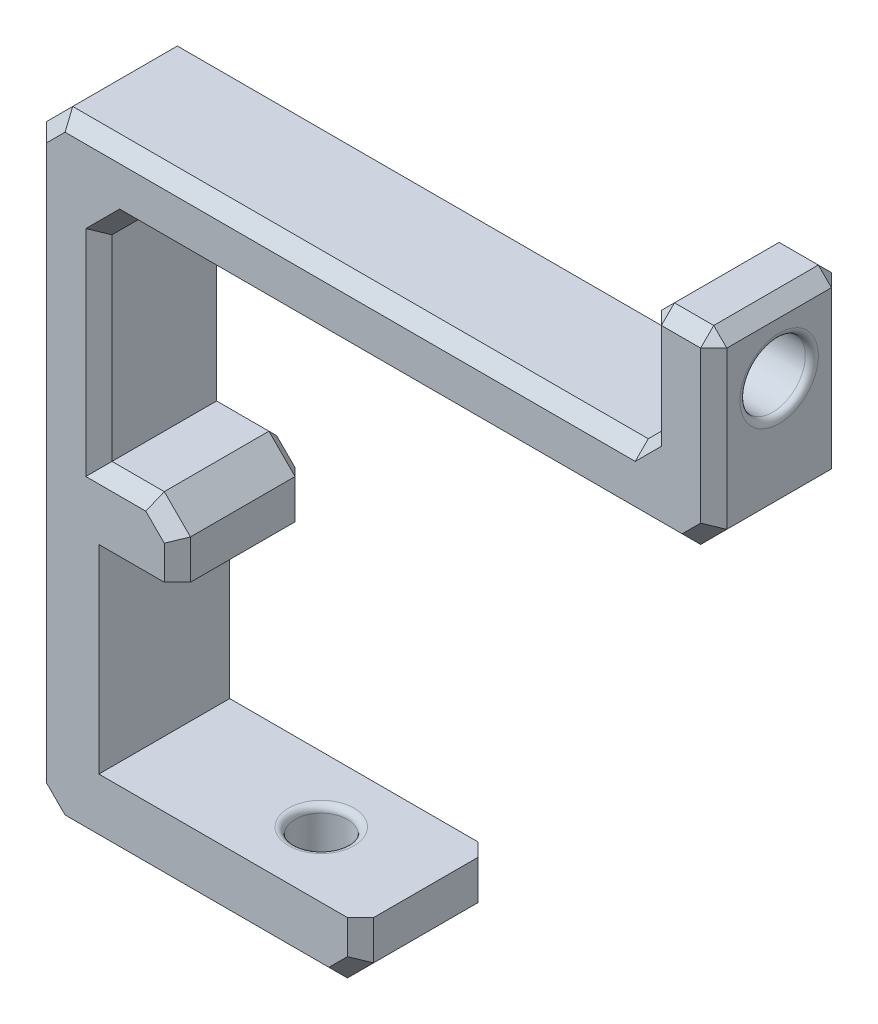
from build123d import *

# Parameters (mm, degrees)
RESSALTO_EXTRUS_O1_DEPTH = 10
ESBO_O3_R                = 2
CORTE_EXTRUS_O1_DEPTH    = 15
CHANFRO1_SIZE            = 1.6
FILETE1_R                = 0.5
CHANFRO5_SIZE            = 2
ESBO_O4_R                = 2.5
CORTE_EXTRUS_O2_DEPTH    = 10
CHANFRO8_SIZE            = 1
FILETE2_R                = 0.5


with BuildPart() as part:
    # Esboço1 → Ressalto-extrusão1 (new body)
    with BuildSketch(Plane.XY):
        Polygon((1.886382163, -7.75), (-4.113617837, -7.75), (-4.113617837, -22.95), (15.886382163, -22.95), (15.886382163, -27.95), (-9.113617837, -27.95), (-9.113617837, 19.25), (37.886382163, 19.25), (37.886382163, 29.25), (42.886382163, 29.25), (42.886382163, 14.25), (-4.113617837, 14.25), (-4.113617837, -2.75), (1.886382163, -2.75), align=None)
    extrude(amount=RESSALTO_EXTRUS_O1_DEPTH)

    # Esboço3 → Corte-extrusão1 (cut)
    with BuildSketch(Plane.XZ.offset(27.95)):
        with Locations(Location((7.886382163, 5, 0), (0, 0, 270))):
            Circle(ESBO_O3_R)
    extrude(amount=-CORTE_EXTRUS_O1_DEPTH, mode=Mode.SUBTRACT)

    # Chanfro1
    chanfro1_edges = [part.edges().sort_by_distance(p)[0] for p in [
        (7.886382163, -27.95, 7),
    ]]
    chamfer(chanfro1_edges, length=CHANFRO1_SIZE)

    # Filete1
    filete1_edges = [part.edges().sort_by_distance(p)[0] for p in [
        (7.886382163, -22.95, 7),
    ]]
    fillet(filete1_edges, radius=FILETE1_R)

    # Chanfro5
    chanfro5_edges = [part.edges().sort_by_distance(p)[0] for p in [
        (15.886382163, -27.95, 5),
        (-9.113617837, -27.95, 5),
        (-9.113617837, 19.25, 5),
        (42.886382163, 14.25, 5),
        (-4.113617837, 14.25, 5),
        (1.886382163, -2.75, 5),
    ]]
    chamfer(chanfro5_edges, length=CHANFRO5_SIZE)

    # Esboço4 → Corte-extrusão2 (cut)
    with BuildSketch(Plane.ZY.offset(-37.886382163)):
        with Locations((5, 24.25)):
            Circle(ESBO_O4_R)
    extrude(amount=-CORTE_EXTRUS_O2_DEPTH, mode=Mode.SUBTRACT)

    # Chanfro8
    chanfro8_edges = [part.edges().sort_by_distance(p)[0] for p in [
        (-4.113617837, 4.75, 10),
        (15.386382163, 19.25, 0),
        (37.886382163, 24.25, 0),
        (40.386382163, 29.25, 0),
        (-4.113617837, 4.75, 0),
        (1.886382163, -6.25, 0),
        (37.886382163, 19.25, 5),
        (37.886382163, 29.25, 5),
        (42.886382163, 29.25, 5),
        (40.386382163, 29.25, 10),
        (37.886382163, 24.25, 10),
        (15.386382163, 19.25, 10),
        (1.886382163, -6.25, 10),
        (-9.113617837, -4.35, 0),
        (-9.113617837, -4.35, 10),
        (15.886382163, -24.45, 0),
        (3.386382163, -27.95, 0),
        (42.886382163, 22.75, 0),
        (19.386382163, 14.25, 0),
        (-2.113617837, -2.75, 0),
        (0.886382163, -3.75, 0),
        (14.886382163, -26.95, 0),
        (-8.113617837, -26.95, 0),
        (41.886382163, 15.25, 0),
        (-8.113617837, 18.25, 0),
        (-2.113617837, -2.75, 10),
        (19.386382163, 14.25, 10),
        (42.886382163, 22.75, 10),
        (3.386382163, -27.95, 10),
        (15.886382163, -24.45, 10),
        (0.886382163, -3.75, 10),
        (14.886382163, -26.95, 10),
        (-8.113617837, -26.95, 10),
        (41.886382163, 15.25, 10),
        (-8.113617837, 18.25, 10),
        (-3.113617837, 13.25, 0),
        (-3.113617837, 13.25, 10),
    ]]
    chamfer(chanfro8_edges, length=CHANFRO8_SIZE)

    # Filete2
    filete2_edges = [part.edges().sort_by_distance(p)[0] for p in [
        (42.886382163, 24.25, 2.5),
        (37.886382163, 24.25, 2.5),
    ]]
    fillet(filete2_edges, radius=FILETE2_R)


solid = part.part
